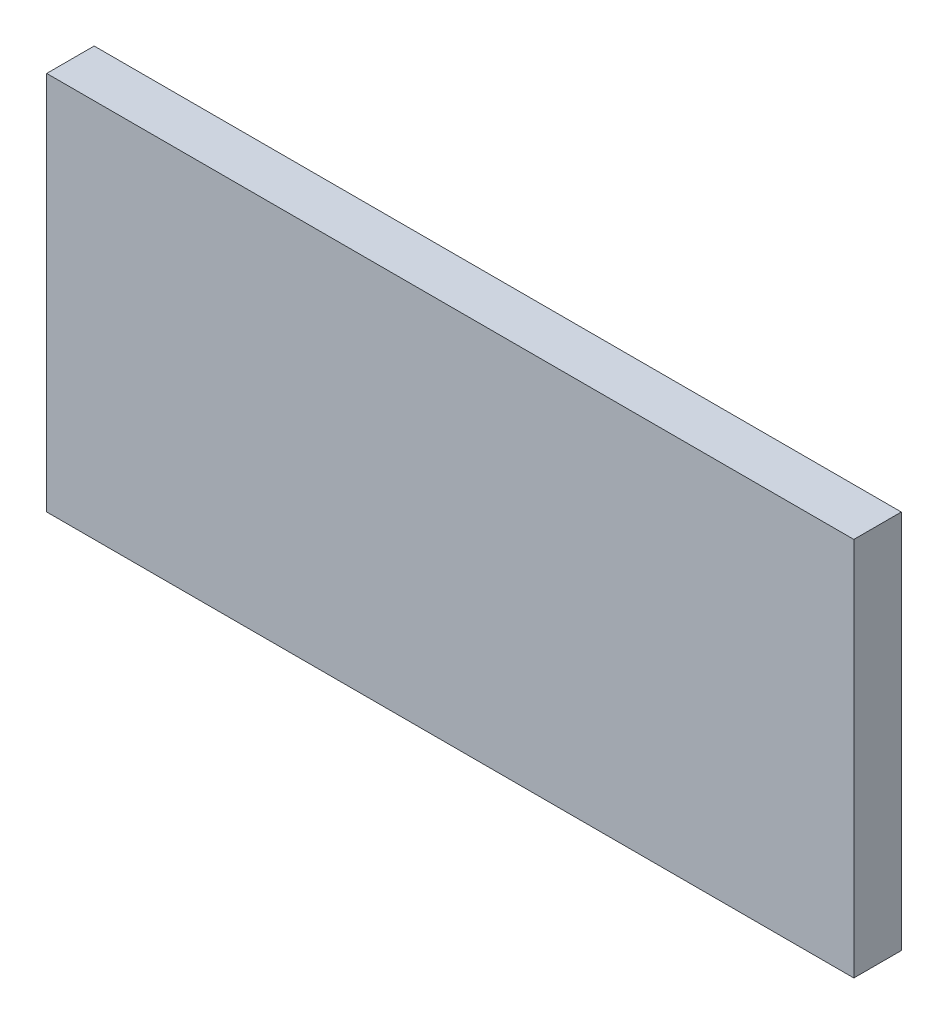
from build123d import *

# Parameters (mm, degrees)
ESQUISSE1_W        = 85
ESQUISSE1_H        = 40
BOSS_EXTRU_1_DEPTH = 5


with BuildPart() as part:
    # Esquisse1 → Boss.-Extru.1 (new body)
    with BuildSketch(Plane.XY):
        Rectangle(ESQUISSE1_W, ESQUISSE1_H)
    extrude(amount=BOSS_EXTRU_1_DEPTH)


solid = part.part
